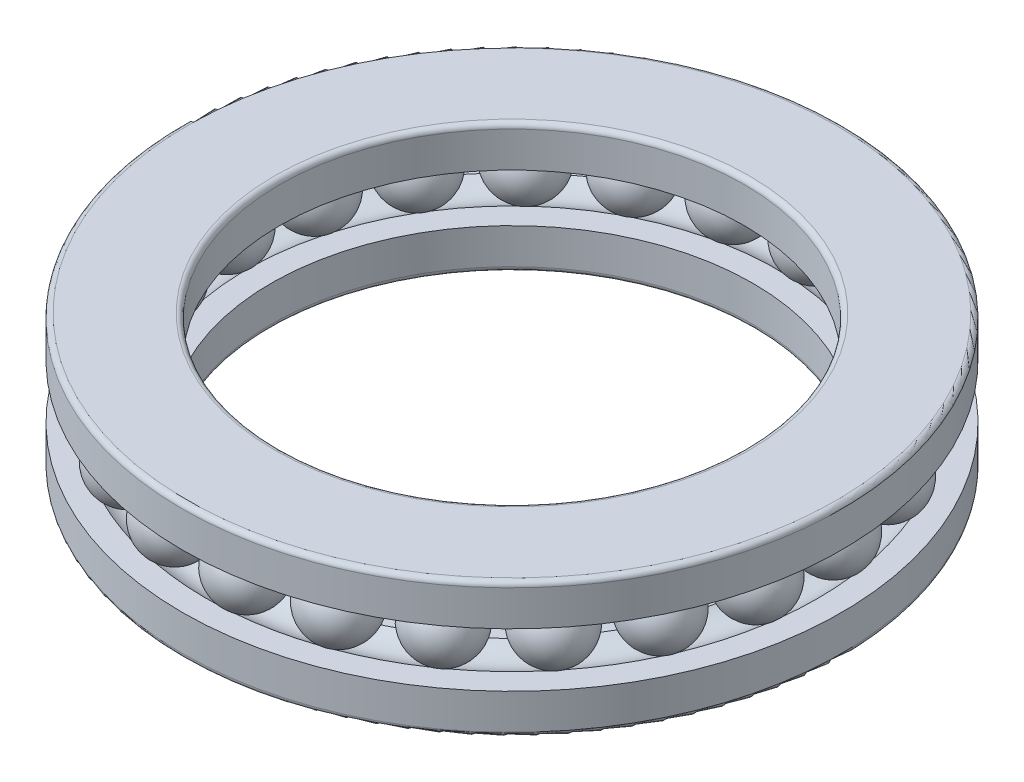
from build123d import *

# Parameters (mm, degrees)
PATTERN_CIRCULAR_1_COUNT = 23
FILLET_1_R               = 0.6


with BuildPart() as part:
    # 草图2 → Revolve 750 (revolve)
    with BuildSketch(Plane.XY, mode=Mode.PRIVATE) as revolve_750_sk:
        with BuildLine():
            Line((0, 4.8), (2.85, 4.8))
            ThreePointArc((2.85, 4.8), (5.25, 4), (7.65, 4.8))
            Line((7.65, 4.8), (10.5, 4.8))
            Line((10.5, 4.8), (10.5, 0))
            Line((10.5, 0), (0, 0))
            Line((0, 0), (0, 4.8))
        make_face()
    revolve(revolve_750_sk.sketch.rotate(Axis((39, 0, 0), (0, 1, 0)), 270), axis=Axis((39, 0, 0), (0, 1, 0)))

    # 草图3 → 凸台-旋转2 (revolve)
    with BuildSketch(Plane.XY):
        with BuildLine():
            Line((5.25, 3.95), (5.25, 12.05))
            ThreePointArc((5.25, 12.05), (1.2, 8), (5.25, 3.95))
        make_face()
    revolve_2 = revolve(axis=Axis((5.25, 0, 0), (0, 1, 0)))

    # 草图4 → 凸台-旋转3 (revolve)
    with BuildSketch(Plane.XY, mode=Mode.PRIVATE) as revolve_3_sk:
        with BuildLine():
            Line((0, 11.2), (2.85, 11.2))
            ThreePointArc((2.85, 11.2), (5.25, 12), (7.65, 11.2))
            Line((7.65, 11.2), (11.5, 11.2))
            Line((11.5, 11.2), (11.5, 16))
            Line((11.5, 16), (0, 16))
            Line((0, 16), (0, 11.2))
        make_face()
    revolve(revolve_3_sk.sketch.rotate(Axis((39, 0, 0), (0, 1, 0)), 270), axis=Axis((39, 0, 0), (0, 1, 0)))

    # 阵列(圆周)1: 凸台-旋转2 ×23 about axis
    pattern_circular_1_axis = Axis((39, 0, 0), (0, 1, 0))
    for i in range(1, PATTERN_CIRCULAR_1_COUNT):
        add(revolve_2.rotate(pattern_circular_1_axis, i * 360 / PATTERN_CIRCULAR_1_COUNT))

    # 圆角1
    fillet_1_edges = [part.edges().sort_by_distance(p)[0] for p in [
        (39, 16, 27.5),
        (39, 16, 39),
        (39, 0, 28.5),
        (39, 0, 39),
    ]]
    fillet(fillet_1_edges, radius=FILLET_1_R)


solid = part.part
